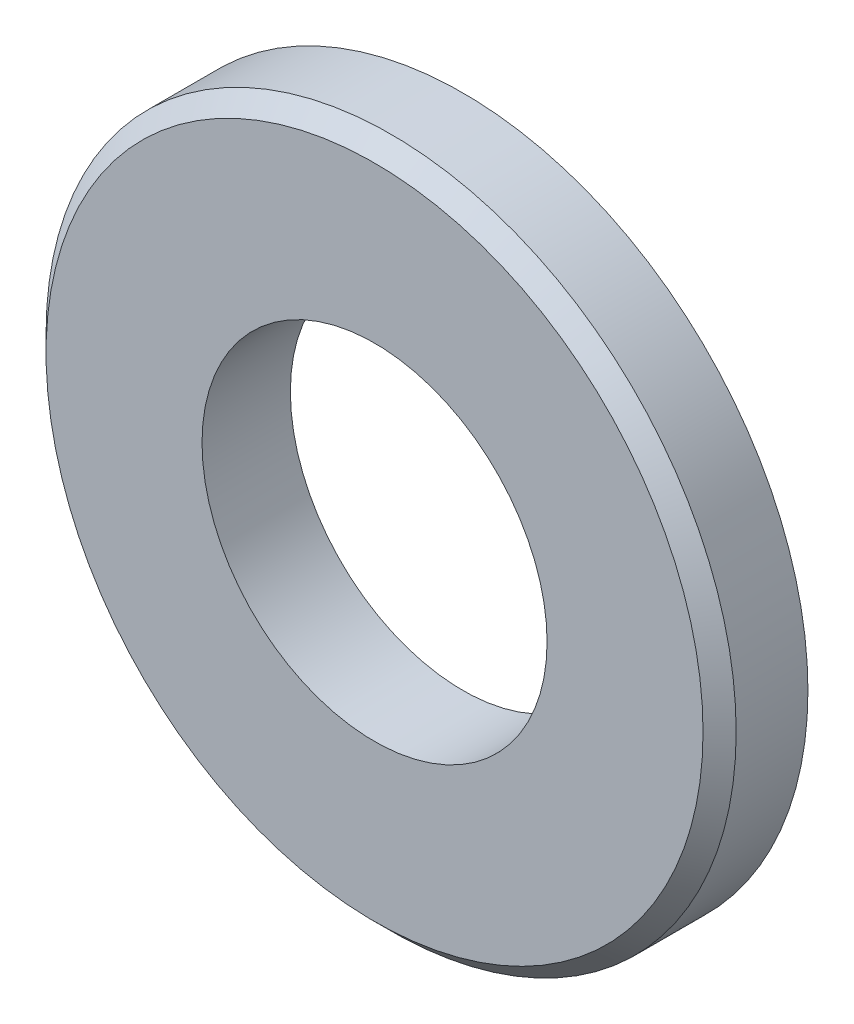
from build123d import *

# Parameters (mm, degrees)
CROQUIS1_R              = 6.25
CROQUIS1_R_2            = 3.125
SALIENTE_EXTRUIR1_DEPTH = 1.6
CHAFL_N1_SIZE           = 0.3


with BuildPart() as part:
    # Croquis1 → Saliente-Extruir1 (new body)
    with BuildSketch(Plane.XY):
        Circle(CROQUIS1_R)
        Circle(CROQUIS1_R_2, mode=Mode.SUBTRACT)
    extrude(amount=SALIENTE_EXTRUIR1_DEPTH)

    # Chaflán1
    chafl_n1_edges = [part.edges().sort_by_distance(p)[0] for p in [
        (-6.25, 0, 1.6),
    ]]
    chamfer(chafl_n1_edges, length=CHAFL_N1_SIZE)


solid = part.part
